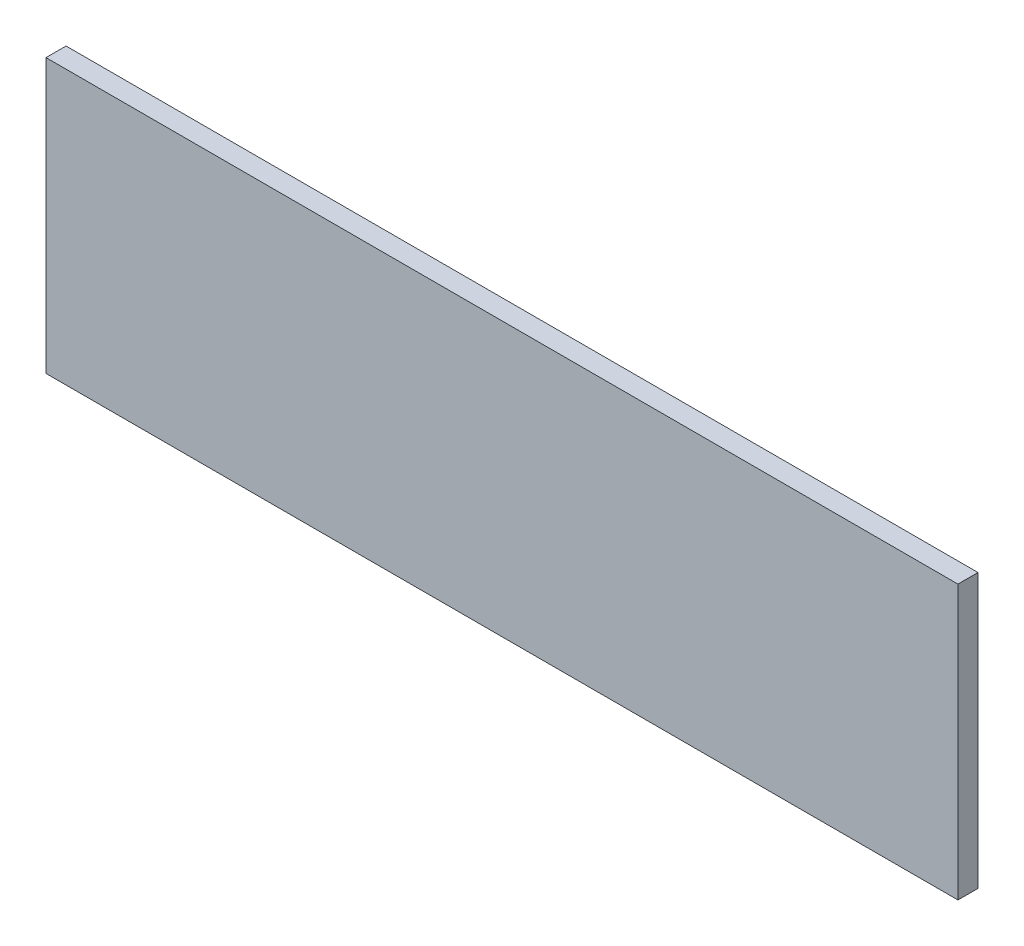
from build123d import *

# Parameters (mm, degrees)
SKETCH1_W           = 254
SKETCH1_H           = 76.2
BOSS_EXTRUDE1_DEPTH = 5.588


with BuildPart() as part:
    # Sketch1 → Boss-Extrude1 (new body)
    with BuildSketch(Plane.XY):
        Rectangle(SKETCH1_W, SKETCH1_H)
    extrude(amount=BOSS_EXTRUDE1_DEPTH)


solid = part.part
